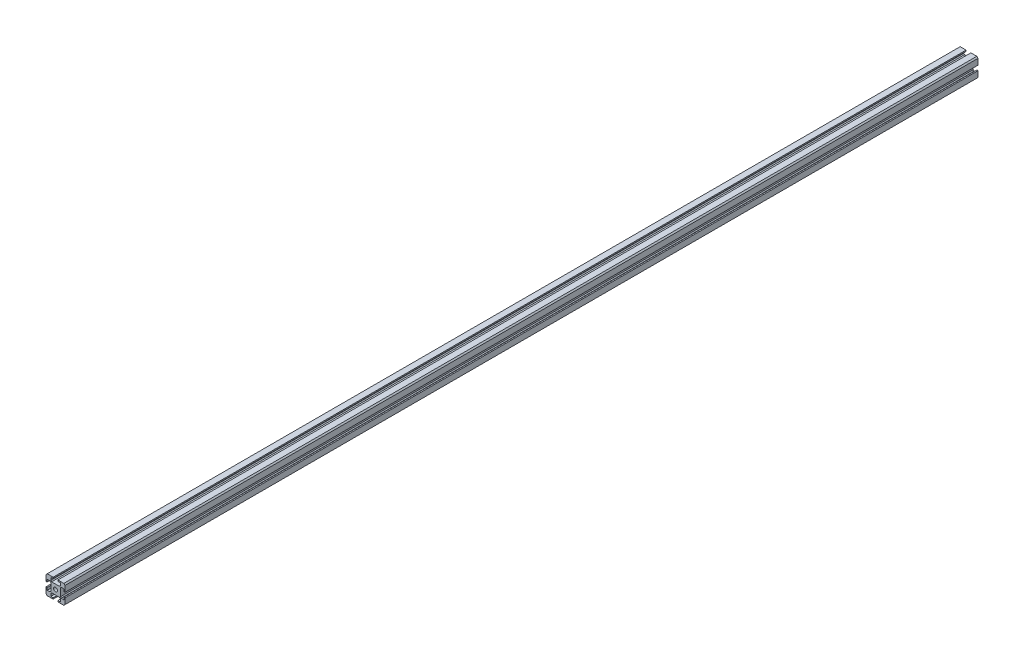
from build123d import *

# Parameters (mm, degrees)
SKETCH1_R      = 2.6035
EXTRUDE1_DEPTH = 1219.2
CHAMFER1_SIZE  = 1.5875


with BuildPart() as part:
    # Sketch1 → Extrude1 (new body)
    with BuildSketch(Plane.XY):
        Polygon((12.7, 3.175), (12.7, 12.7), (3.175, 12.7), (3.175, 11.1125), (6.35, 11.1125), (6.35, 7.472532015), (5.227467985, 6.35), (-5.227467985, 6.35), (-6.35, 7.472532015), (-6.35, 11.1125), (-3.175, 11.1125), (-3.175, 12.7), (-12.7, 12.7), (-12.7, 3.175), (-11.1125, 3.175), (-11.1125, 6.35), (-7.472532015, 6.35), (-6.35, 5.227467985), (-6.35, -5.227467985), (-7.472532015, -6.35), (-11.1125, -6.35), (-11.1125, -3.175), (-12.7, -3.175), (-12.7, -12.7), (-3.175, -12.7), (-3.175, -11.1125), (-6.35, -11.1125), (-6.35, -7.472532015), (-5.227467985, -6.35), (5.227467985, -6.35), (6.35, -7.472532015), (6.35, -11.1125), (3.175, -11.1125), (3.175, -12.7), (12.7, -12.7), (12.7, -3.175), (11.1125, -3.175), (11.1125, -6.35), (7.472532015, -6.35), (6.35, -5.227467985), (6.35, 5.227467985), (7.472532015, 6.35), (11.1125, 6.35), (11.1125, 3.175), align=None)
        with Locations(Location((0, 0, 0), (0, 0, 180))):
            Circle(SKETCH1_R, mode=Mode.SUBTRACT)
    extrude(amount=EXTRUDE1_DEPTH)

    # Chamfer1
    chamfer1_edges = [part.edges().sort_by_distance(p)[0] for p in [
        (12.7, -12.7, 609.6),
        (-12.7, -12.7, 609.6),
        (-12.7, 12.7, 609.6),
        (12.7, 12.7, 609.6),
    ]]
    chamfer(chamfer1_edges, length=CHAMFER1_SIZE)


solid = part.part
